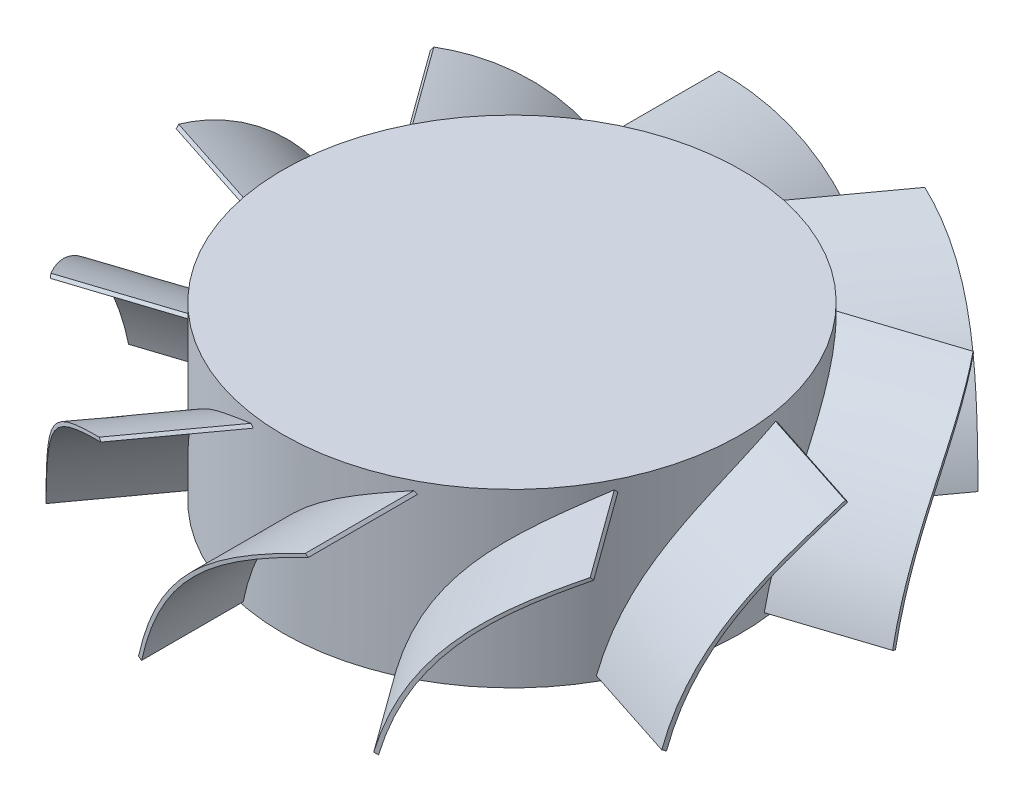
from build123d import *

# Parameters (mm, degrees)
SKETCH1_R           = 8
BOSS_EXTRUDE1_DEPTH = 6
BOSS_EXTRUDE2_DEPTH = 11.5
CIRPATTERN1_COUNT   = 10
SKETCH3_R           = 12.5
SKETCH3_R_2         = 11.5
CUT_EXTRUDE1_DEPTH  = 18.748286015


with BuildPart() as part:
    # Sketch1 → Boss-Extrude1 (new body)
    with BuildSketch(Plane(origin=(0, 0, 0), x_dir=(1, 0, 0), z_dir=(0, 1, 0))):
        with Locations(Location((0, 0, 0), (0, 0, 270))):
            Circle(SKETCH1_R)
    extrude(amount=BOSS_EXTRUDE1_DEPTH)

    # Sketch2 → Boss-Extrude2 (add)
    with BuildSketch(Plane.XY):
        with BuildLine():
            Line((-1.651468378, 0.172502835), (-1.529156838, 0.107612907))
            add(Edge.make_bspline(
                [(-1.529156838, 0.107612907), (-0.51275618, 4.268117944), (3.762269626, 5.602884151)],
                knots=[0, 0, 0, 1, 1, 1], degree=2))
            Line((3.762269626, 5.602884151), (3.679470908, 5.697511258))
            add(Edge.make_bspline(
                [(-1.651468378, 0.172502835), (-0.622191905, 4.338601579), (3.679470908, 5.697511258)],
                knots=[0, 0, 0, 1, 1, 1], degree=2))
        make_face()
    boss_extrude2 = extrude(amount=BOSS_EXTRUDE2_DEPTH)

    # CirPattern1: Boss-Extrude2 ×10 about axis
    cirpattern1_axis = Axis((0, 0, 0), (0, 1, 0))
    for i in range(1, CIRPATTERN1_COUNT):
        add(boss_extrude2.rotate(cirpattern1_axis, i * 360 / CIRPATTERN1_COUNT))

    # Sketch3 → Cut-Extrude1 (cut, through all)
    with BuildSketch(Plane(origin=(0, 6, 0), x_dir=(1, 0, 0), z_dir=(0, 1, 0))):
        Circle(SKETCH3_R)
        Circle(SKETCH3_R_2, mode=Mode.SUBTRACT)
    extrude(amount=-CUT_EXTRUDE1_DEPTH, mode=Mode.SUBTRACT)


solid = part.part
